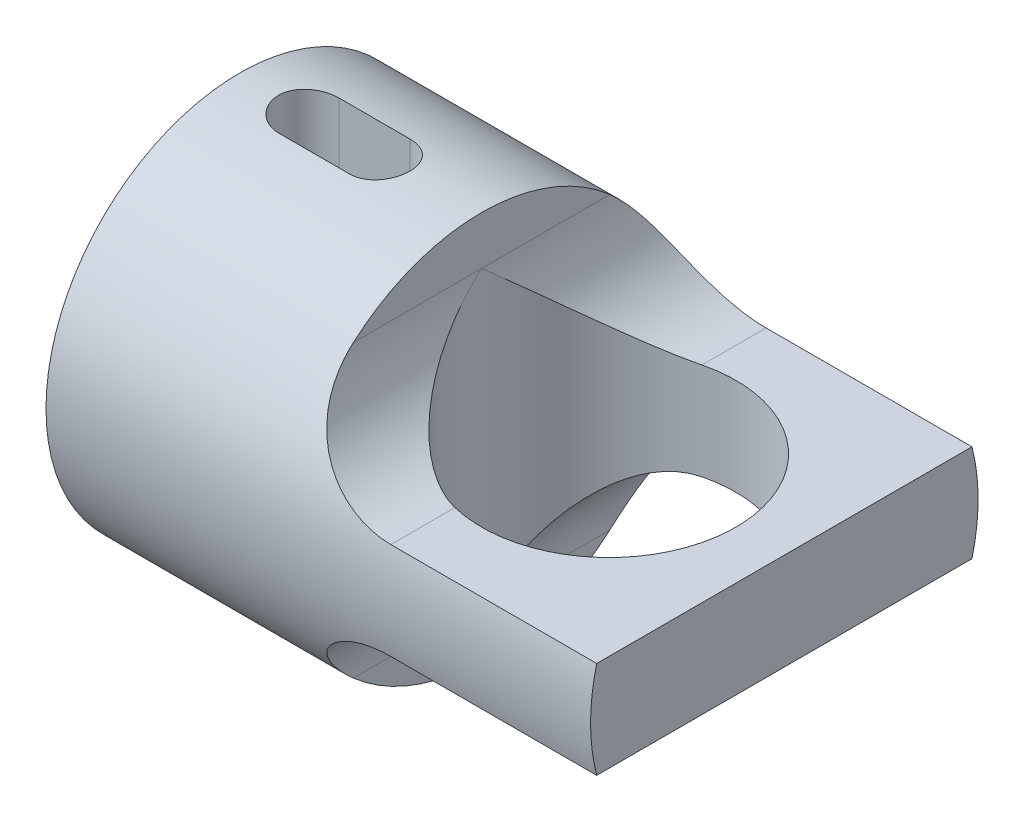
from build123d import *

# Parameters (mm, degrees)
CUT_EXTRUDE1_DEPTH      = 869.726648215
CUT_EXTRUDE1_DEPTH_BACK = 869.726648215
SKETCH2_3_R             = 8.334375
SKETCH3_R               = 6.44921875
CUT_EXTRUDE2_DEPTH      = 14.2875
CUT_EXTRUDE4_DEPTH      = 184.852841047


with BuildPart() as part:
    # Sketch2 one side → Revolve1 (revolve)
    with BuildSketch(Plane(origin=(0, 0, 0), x_dir=(1, 0, 0), z_dir=(0, 1, 0)), mode=Mode.PRIVATE) as revolve1_sk:
        with BuildLine():
            Line((161.802656837, 836.728797606), (178.471406837, 836.728797606))
            ThreePointArc((178.471406837, 836.728797606), (170.137031837, 845.063172606), (161.802656837, 836.728797606))
        make_face()
        with BuildLine():
            Line((155.119281837, 838.713172606), (150.479125, 838.713172606))
            ThreePointArc((150.479125, 838.713172606), (149.075959981, 838.131962625), (148.49475, 836.728797606))
            Line((148.49475, 836.728797606), (157.103656837, 836.728797606))
            ThreePointArc((157.103656837, 836.728797606), (156.522446856, 838.131962625), (155.119281837, 838.713172606))
        make_face()
        Polygon((144.800531837, 845.999797606), (144.800531837, 836.728797606), (181.646406837, 836.728797606), (181.646406837, 849.428797606), (145.956231837, 849.428797606), (145.956231837, 845.999797606), align=None)
    revolve(revolve1_sk.sketch.rotate(Axis((144.800531837, 0, -836.728797606), (1, 0, 0)), 180), axis=Axis((144.800531837, 0, -836.728797606), (1, 0, 0)))

    # Sketch2<3> → Cut-Extrude1 (cut, two sides: drawn at the far end of the back side and taken through both)
    with BuildSketch(Plane(origin=(0, 0, 0), x_dir=(1, 0, 0), z_dir=(0, 1, 0)).offset(-CUT_EXTRUDE1_DEPTH_BACK)):
        with Locations(Location((170.137031837, 836.728797606, 0), (0, 0, 270))):
            Circle(SKETCH2_3_R)
        with BuildLine():
            Line((150.479125, 838.713172606), (155.119281837, 838.713172606))
            ThreePointArc((155.119281837, 838.713172606), (157.103656837, 836.728797606), (155.119281837, 834.744422606))
            Line((155.119281837, 834.744422606), (150.479125, 834.744422606))
            ThreePointArc((150.479125, 834.744422606), (148.49475, 836.728797606), (150.479125, 838.713172606))
        make_face()
    extrude(amount=CUT_EXTRUDE1_DEPTH + CUT_EXTRUDE1_DEPTH_BACK, mode=Mode.SUBTRACT)

    # Sketch3 → Cut-Extrude2 (cut)
    with BuildSketch(Plane.ZY.offset(-144.800531837)):
        with Locations((-836.728797606, 0)):
            Circle(SKETCH3_R)
    extrude(amount=-CUT_EXTRUDE2_DEPTH, mode=Mode.SUBTRACT)

    # Sketch5 → Cut-Extrude4 (cut, through all)
    with BuildSketch(Plane.XY.offset(-824.028797606)):
        with BuildLine():
            Line((168.152656837, 3.175), (181.646406837, 3.175))
            Line((181.646406837, 3.175), (181.646406837, 12.7))
            Line((181.646406837, 12.7), (161.802656837, 12.7))
            Line((161.802656837, 12.7), (161.802656837, 9.525))
            ThreePointArc((161.802656837, 9.525), (163.662528777, 5.034871939), (168.152656837, 3.175))
        make_face()
        with BuildLine():
            Line((161.802656837, -12.7), (181.646406837, -12.7))
            Line((181.646406837, -12.7), (181.646406837, -3.175))
            Line((181.646406837, -3.175), (168.152656837, -3.175))
            ThreePointArc((168.152656837, -3.175), (163.662528777, -5.034871939), (161.802656837, -9.525))
            Line((161.802656837, -9.525), (161.802656837, -12.7))
        make_face()
    extrude(amount=-CUT_EXTRUDE4_DEPTH, mode=Mode.SUBTRACT)


solid = part.part
